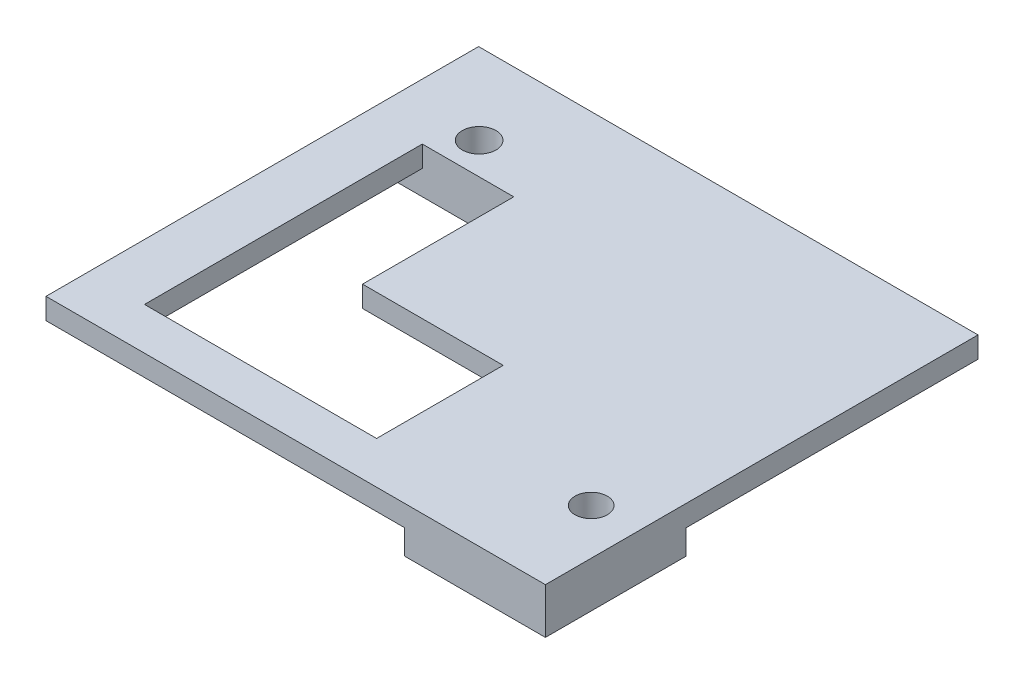
from build123d import *

# Parameters (mm, degrees)
SKETCH1_W           = 45.5
SKETCH1_H           = 30.75
BOSS_EXTRUDE1_DEPTH = 1.5
CUT_EXTRUDE1_DEPTH  = 55.936895617
SKETCH3_W           = 10
SKETCH3_H           = 10
SKETCH3_W_2         = 8
SKETCH3_H_2         = 8
BOSS_EXTRUDE2_DEPTH = 3.25
SKETCH4_R           = 1.15
SKETCH4_R_2         = 1.2
CUT_EXTRUDE2_DEPTH  = 56.01249858


with BuildPart() as part:
    # Sketch1 → Boss-Extrude1 (new body)
    with BuildSketch(Plane(origin=(0, 0, 0), x_dir=(1, 0, 0), z_dir=(0, 1, 0))):
        with Locations((22.75, 15.375)):
            Rectangle(SKETCH1_W, SKETCH1_H)
    extrude(amount=BOSS_EXTRUDE1_DEPTH)

    # Sketch2 → Cut-Extrude1 (cut, through all)
    with BuildSketch(Plane(origin=(0, 1.5, 0), x_dir=(1, 0, 0), z_dir=(0, 1, 0))):
        Polygon((0, 0), (10, 0), (10, 22.75), (10, 30.75), (0, 30.75), align=None)
        Polygon((14, 3), (30.5, 3), (30.5, 12), (20.5, 12), (20.5, 22.75), (14, 22.75), align=None)
    extrude(amount=-CUT_EXTRUDE1_DEPTH, mode=Mode.SUBTRACT)

    # Sketch3 → Boss-Extrude2 (add)
    with BuildSketch(Plane(origin=(0, 1.5, 0), x_dir=(1, 0, 0), z_dir=(0, 1, 0))):
        with Locations((40.5, 5)):
            Rectangle(SKETCH3_W, SKETCH3_H)
        with Locations((16, 26.75)):
            Rectangle(SKETCH3_W_2, SKETCH3_H_2)
    extrude(amount=-BOSS_EXTRUDE2_DEPTH)

    # Sketch4 → Cut-Extrude2 (cut, through all)
    with BuildSketch(Plane(origin=(0, -1.75, 0), x_dir=(-1, 0, 0), z_dir=(0, -1, 0))):
        with Locations(Location((-42.25, 6.5, 0), (0, 0, 90))):
            Circle(SKETCH4_R)
        with Locations(Location((-15.79, 25, 0), (0, 0, 90))):
            Circle(SKETCH4_R_2)
    extrude(amount=-CUT_EXTRUDE2_DEPTH, mode=Mode.SUBTRACT)


solid = part.part
